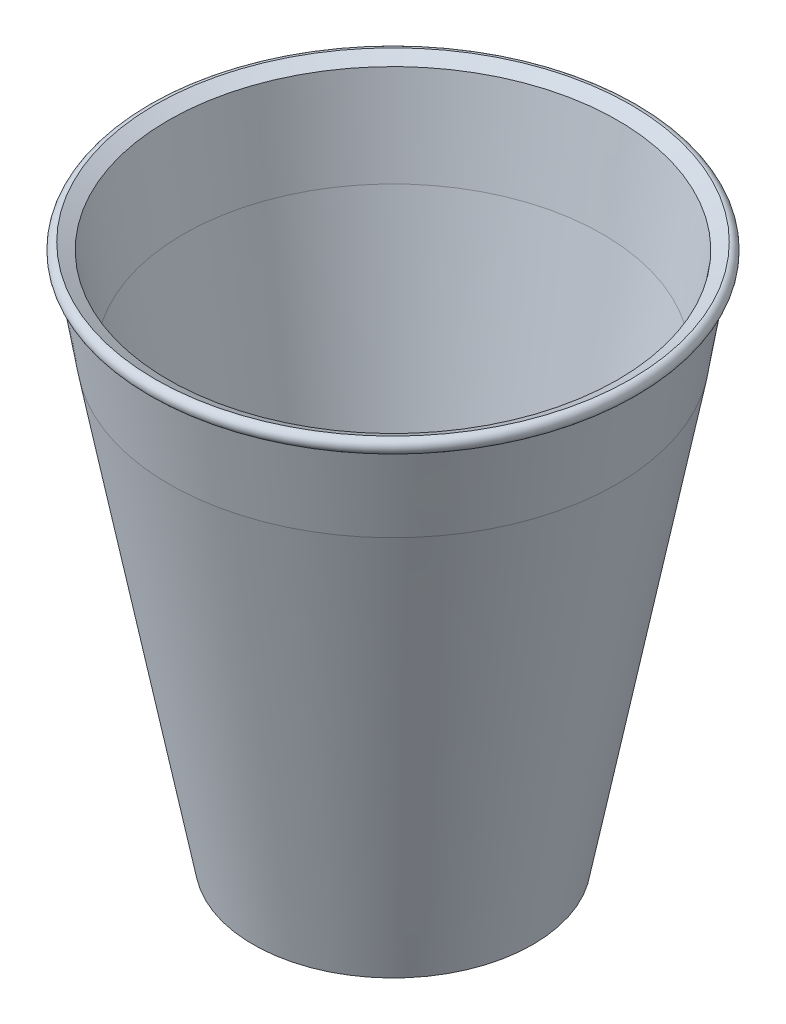
from build123d import *

# Parameters (mm, degrees)
BOSS_EXTRUDE1_START = -0.5
BOSS_EXTRUDE1_DEPTH = 0.5
CUT_EXTRUDE1_DEPTH  = 0.5
CIRPATTERN2_COUNT   = 4


with BuildPart() as part:
    # Sketch1 → Revolve1 (revolve)
    with BuildSketch(Plane.XY):
        with BuildLine():
            Line((-32.130708731, -1), (-34, 0))
            ThreePointArc((-34, 0), (-35, -1), (-34, -2))
            Line((-34, -2), (-32, -14))
            Line((-32, -14), (-20, -77))
            Line((-20, -77), (-12.6, -77))
            Line((-12.6, -77), (-12.6, -75.5))
            Line((-12.6, -75.5), (0, -75.5))
            Line((0, -75.5), (0, -74))
            Line((0, -74), (-18.535470636, -74))
            Line((-18.535470636, -74), (-29.964042064, -14))
            Line((-29.964042064, -14), (-32.130708731, -1))
        make_face()
    revolve(axis=Axis((0, 0, 0), (0, -1, 0)))

    # Sketch3 → Boss-Extrude1 (add)
    with BuildSketch(Plane.XZ.offset(77).offset(BOSS_EXTRUDE1_START)):
        with BuildLine():
            Line((-0.25, 12.597519597), (-0.25, 11.997519597))
            Line((-0.25, 11.997519597), (0.25, 11.997519597))
            Line((0.25, 11.997519597), (0.25, 12.597519597))
            ThreePointArc((0.25, 12.597519597), (0, 12.6), (-0.25, 12.597519597))
        make_face()
    boss_extrude1 = extrude(amount=BOSS_EXTRUDE1_DEPTH)

    # Sketch8 → Cut-Extrude1 (cut)
    with BuildSketch(Plane.ZY.offset(0.25)):
        Polygon((11.997519597, -76.75), (12.597519597, -77), (11.997519597, -77), align=None)
    cut_extrude1 = extrude(amount=-CUT_EXTRUDE1_DEPTH, mode=Mode.SUBTRACT)

    # CirPattern2: Boss-Extrude1, Cut-Extrude1 ×4 about axis
    cirpattern2_axis = Axis((0, 0, 0), (0, 1, 0))
    add([boss_extrude1.rotate(cirpattern2_axis, i * 360 / CIRPATTERN2_COUNT) for i in range(1, CIRPATTERN2_COUNT)])
    add([cut_extrude1.rotate(cirpattern2_axis, i * 360 / CIRPATTERN2_COUNT) for i in range(1, CIRPATTERN2_COUNT)], mode=Mode.SUBTRACT)


solid = part.part
